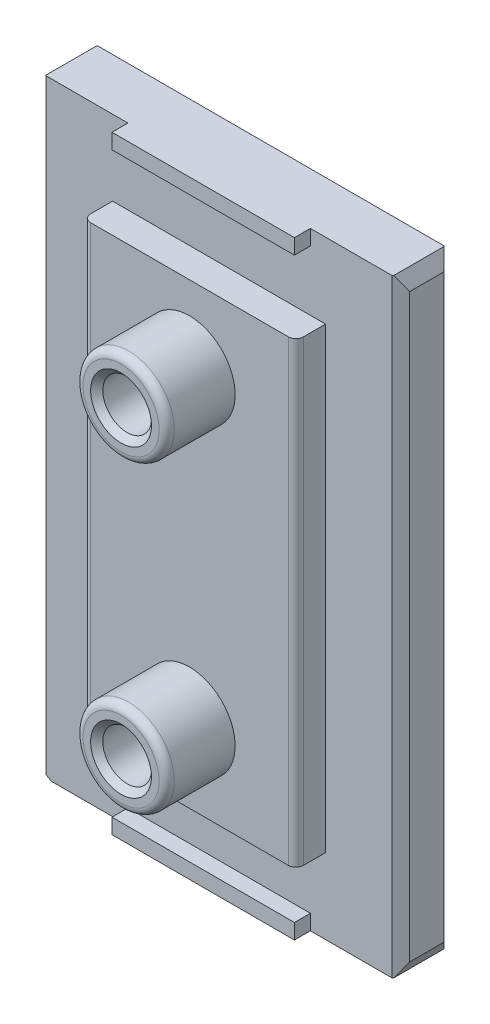
from build123d import *
from OCP.BRepFilletAPI import BRepFilletAPI_MakeChamfer

# Parameters (mm, degrees)
ESQUISSE1_W                                        = 23.9
ESQUISSE1_H                                        = 40
BOSS_EXTRU_1_DEPTH                                 = 3.4
ENL_V_MAT_EXTRU_1_DEPTH                            = 30
ESQUISSE3_W                                        = 14
ESQUISSE3_H                                        = 30.1
BOSS_EXTRU_2_DEPTH                                 = 1.95
ESQUISSE4_W                                        = 10.4
ESQUISSE4_H                                        = 30
ENL_V_MAT_EXTRU_2_DEPTH                            = 1.55
ENL_V_MAT_EXTRU_3_REACH                            = 25.71
ESQUISSE6_W                                        = 10.4
ESQUISSE6_H                                        = 1.75
ENL_V_MAT_EXTRU_4_REACH                            = 25.71
ESQUISSE8_W                                        = 10.4
ESQUISSE8_H                                        = 1.75
ESQUISSE9_W                                        = 0.6
ESQUISSE9_H                                        = 30
ENL_V_MAT_EXTRU_5_DEPTH                            = 1.8
ESQUISSE10_W                                       = 0.6
ESQUISSE10_H                                       = 30
ENL_V_MAT_EXTRU_6_DEPTH                            = 1.8
ESQUISSE11_W                                       = 12
ESQUISSE11_H                                       = 1
BOSS_EXTRU_3_DEPTH                                 = 1.05
ESQUISSE12_W                                       = 12
ESQUISSE12_H                                       = 1
BOSS_EXTRU_4_DEPTH                                 = 1.05
ESQUISSE13_W                                       = 3
ESQUISSE13_H                                       = 4.5
ESQUISSE14_W                                       = 3
ESQUISSE14_H                                       = 4.5
CHAMBRAGE_POUR_VIS_T_TE_HEXAGONALE_M31_D           = 3.2
CHAMBRAGE_POUR_VIS_T_TE_HEXAGONALE_M31_CBORE_D     = 8
CHAMBRAGE_POUR_VIS_T_TE_HEXAGONALE_M31_CBORE_DEPTH = 2.3
CHANFREIN1_SIZE                                    = 0.913344887
CHANFREIN1_SIZE2                                   = 0.527
CHANFREIN2_SIZE                                    = 0.527
CHANFREIN2_SIZE2                                   = 0.913344887
CHANFREIN3_SIZE                                    = 0.577
CHANFREIN4_SIZE                                    = 0.4
CONG_1_R                                           = 0.5


with BuildPart() as part:
    # Esquisse1 → Boss.-Extru.1 (new body)
    with BuildSketch(Plane.XY.offset(7.55)):
        Rectangle(ESQUISSE1_W, ESQUISSE1_H)
    extrude(amount=-BOSS_EXTRU_1_DEPTH)

    # Esquisse2 → Enlèv. mat.-Extru.1 (cut)
    with BuildSketch(Plane(origin=(0, 15, 0), x_dir=(1, 0, 0), z_dir=(0, 1, 0))):
        with BuildLine():
            Line((6.995, -7.4), (6.995, -7.55))
            Line((6.995, -7.55), (7, -7.55))
            Line((7, -7.55), (7, -7.310697145))
            ThreePointArc((7, -7.310697145), (6.996250978, -7.35527864), (6.995, -7.4))
        make_face()
    extrude(amount=-ENL_V_MAT_EXTRU_1_DEPTH, mode=Mode.SUBTRACT)

    # Esquisse3 → Boss.-Extru.2 (add)
    with BuildSketch(Plane.XY.offset(7.55)):
        with Locations((-0.005, 0)):
            Rectangle(ESQUISSE3_W, ESQUISSE3_H)
    extrude(amount=BOSS_EXTRU_2_DEPTH)

    # Esquisse4 → Enlèv. mat.-Extru.2 (cut)
    with BuildSketch(Plane(origin=(0, 0, 4.15), x_dir=(-1, 0, 0), z_dir=(0, 0, -1))):
        Rectangle(ESQUISSE4_W, ESQUISSE4_H)
    extrude(amount=-ENL_V_MAT_EXTRU_2_DEPTH, mode=Mode.SUBTRACT)

    # Esquisse6 → Enlèv. mat.-Extru.3 (cut, up to next)
    with BuildSketch(Plane.XY.offset(5.1), mode=Mode.PRIVATE) as enl_v_mat_extru_3_sk1:
        with Locations((0, -15.875)):
            Rectangle(ESQUISSE6_W, ESQUISSE6_H)
    enl_v_mat_extru_3_tool1 = extrude(enl_v_mat_extru_3_sk1.sketch, amount=-ENL_V_MAT_EXTRU_3_REACH, mode=Mode.PRIVATE) & part.part
    add(enl_v_mat_extru_3_tool1.solids().sort_by_distance((0, -15.875, 5.1))[0], mode=Mode.SUBTRACT)

    # Esquisse8 → Enlèv. mat.-Extru.4 (cut, up to next)
    with BuildSketch(Plane.XY.offset(5.1), mode=Mode.PRIVATE) as enl_v_mat_extru_4_sk1:
        with Locations((0, 15.875)):
            Rectangle(ESQUISSE8_W, ESQUISSE8_H)
    enl_v_mat_extru_4_tool1 = extrude(enl_v_mat_extru_4_sk1.sketch, amount=-ENL_V_MAT_EXTRU_4_REACH, mode=Mode.PRIVATE) & part.part
    add(enl_v_mat_extru_4_tool1.solids().sort_by_distance((0, 15.875, 5.1))[0], mode=Mode.SUBTRACT)

    # Esquisse9 → Enlèv. mat.-Extru.5 (cut)
    with BuildSketch(Plane.ZY.offset(-5.2)):
        with Locations((5.4, 0)):
            Rectangle(ESQUISSE9_W, ESQUISSE9_H)
    extrude(amount=-ENL_V_MAT_EXTRU_5_DEPTH, mode=Mode.SUBTRACT)

    # Esquisse10 → Enlèv. mat.-Extru.6 (cut)
    with BuildSketch(Plane(origin=(-5.2, 0, 0), x_dir=(0, 0, -1), z_dir=(1, 0, 0))):
        with Locations((-5.4, 0)):
            Rectangle(ESQUISSE10_W, ESQUISSE10_H)
    extrude(amount=-ENL_V_MAT_EXTRU_6_DEPTH, mode=Mode.SUBTRACT)

    # Esquisse11 → Boss.-Extru.3 (add)
    with BuildSketch(Plane.XY.offset(7.55)):
        with Locations((0, -19.5)):
            Rectangle(ESQUISSE11_W, ESQUISSE11_H)
    extrude(amount=BOSS_EXTRU_3_DEPTH)

    # Esquisse12 → Boss.-Extru.4 (add)
    with BuildSketch(Plane.XY.offset(7.55)):
        with Locations((0, 19.5)):
            Rectangle(ESQUISSE12_W, ESQUISSE12_H)
    extrude(amount=BOSS_EXTRU_4_DEPTH)

    # Esquisse13 → Révolution1 (revolve)
    with BuildSketch(Plane.XZ.offset(-10), mode=Mode.PRIVATE) as r_volution1_sk:
        with Locations((1.5, 11.75)):
            Rectangle(ESQUISSE13_W, ESQUISSE13_H)
    revolve(r_volution1_sk.sketch.rotate(Axis((0, 10, 14), (0, 0, -1)), 180), axis=Axis((0, 10, 14), (0, 0, -1)))

    # Esquisse14 → Révolution2 (revolve)
    with BuildSketch(Plane.XZ.offset(10), mode=Mode.PRIVATE) as r_volution2_sk:
        with Locations((1.5, 11.75)):
            Rectangle(ESQUISSE14_W, ESQUISSE14_H)
    revolve(r_volution2_sk.sketch.rotate(Axis((0, -10, 14), (0, 0, -1)), 180), axis=Axis((0, -10, 14), (0, 0, -1)))

    # Chambrage pour vis à tête hexagonale M31 (through all)
    with Locations(Plane(origin=(0, 0, 5.7), x_dir=(-1, 0, 0), z_dir=(0, 0, -1))):
        with Locations((0, -10), (0, 10)):
            CounterBoreHole(CHAMBRAGE_POUR_VIS_T_TE_HEXAGONALE_M31_D / 2, CHAMBRAGE_POUR_VIS_T_TE_HEXAGONALE_M31_CBORE_D / 2, CHAMBRAGE_POUR_VIS_T_TE_HEXAGONALE_M31_CBORE_DEPTH)

    # Chanfrein1
    chanfrein1_edges = [part.edges().sort_by_distance(p)[0] for p in [
        (11.95, 20, 5.85),
    ]]
    chanfrein1_side = [part.faces().sort_by_distance(p)[0] for p in [
        (11.95, 0, 5.85),
    ]]
    chamfer(chanfrein1_edges, length=CHANFREIN1_SIZE, length2=CHANFREIN1_SIZE2, reference=chanfrein1_side[0])

    # Chanfrein2: one chamfer whose edges measure the first distance from different faces: ONE call of the kernel's chamfer builder (chamfer() names one face for all edges)
    chanfrein2_edges_1 = [part.edges().sort_by_distance(p)[0] for p in [
        (11.95, -20, 5.85),
    ]]
    chanfrein2_side_1 = [part.faces().sort_by_distance(p)[0] for p in [
        (0, -20, 6.148689538),
    ]]
    chanfrein2_edges_2 = [part.edges().sort_by_distance(p)[0] for p in [
        (-11.95, -20, 5.85),
    ]]
    chanfrein2_side_2 = [part.faces().sort_by_distance(p)[0] for p in [
        (-11.95, 0, 5.85),
    ]]
    chanfrein2_edges_3 = [part.edges().sort_by_distance(p)[0] for p in [
        (-11.95, 20, 5.85),
    ]]
    chanfrein2_side_3 = [part.faces().sort_by_distance(p)[0] for p in [
        (-0.227438689, 20, 6.154502532),
    ]]
    chanfrein2 = BRepFilletAPI_MakeChamfer(part.part.solid().wrapped)
    for e in chanfrein2_edges_1:
        chanfrein2.Add(CHANFREIN2_SIZE, CHANFREIN2_SIZE2, e.wrapped, chanfrein2_side_1[0].wrapped)  # the first distance lies on this face
    for e in chanfrein2_edges_2:
        chanfrein2.Add(CHANFREIN2_SIZE, CHANFREIN2_SIZE2, e.wrapped, chanfrein2_side_2[0].wrapped)  # the first distance lies on this face
    for e in chanfrein2_edges_3:
        chanfrein2.Add(CHANFREIN2_SIZE, CHANFREIN2_SIZE2, e.wrapped, chanfrein2_side_3[0].wrapped)  # the first distance lies on this face
    add(Compound.cast(chanfrein2.Shape()), mode=Mode.REPLACE)

    # Chanfrein3
    chanfrein3_edges = [part.edges().sort_by_distance(p)[0] for p in [
        (-11.95, -0.193172444, 4.15),
        (-11.95, -0.193172444, 7.55),
        (11.95, 0, 4.15),
        (11.95, 0, 7.55),
    ]]
    chamfer(chanfrein3_edges, length=CHANFREIN3_SIZE)

    # Chanfrein4
    chanfrein4_edges = [part.edges().sort_by_distance(p)[0] for p in [
        (-1.6, 10, 14),
        (-1.6, 10, 8),
        (-1.6, -10, 14),
        (-1.6, -10, 8),
    ]]
    chamfer(chanfrein4_edges, length=CHANFREIN4_SIZE)

    # Congé1
    cong_1_edges = [part.edges().sort_by_distance(p)[0] for p in [
        (3, 10, 14),
        (3, -10, 14),
        (-7.005, 0, 9.5),
        (6.995, 0, 9.5),
    ]]
    fillet(cong_1_edges, radius=CONG_1_R)


solid = part.part
